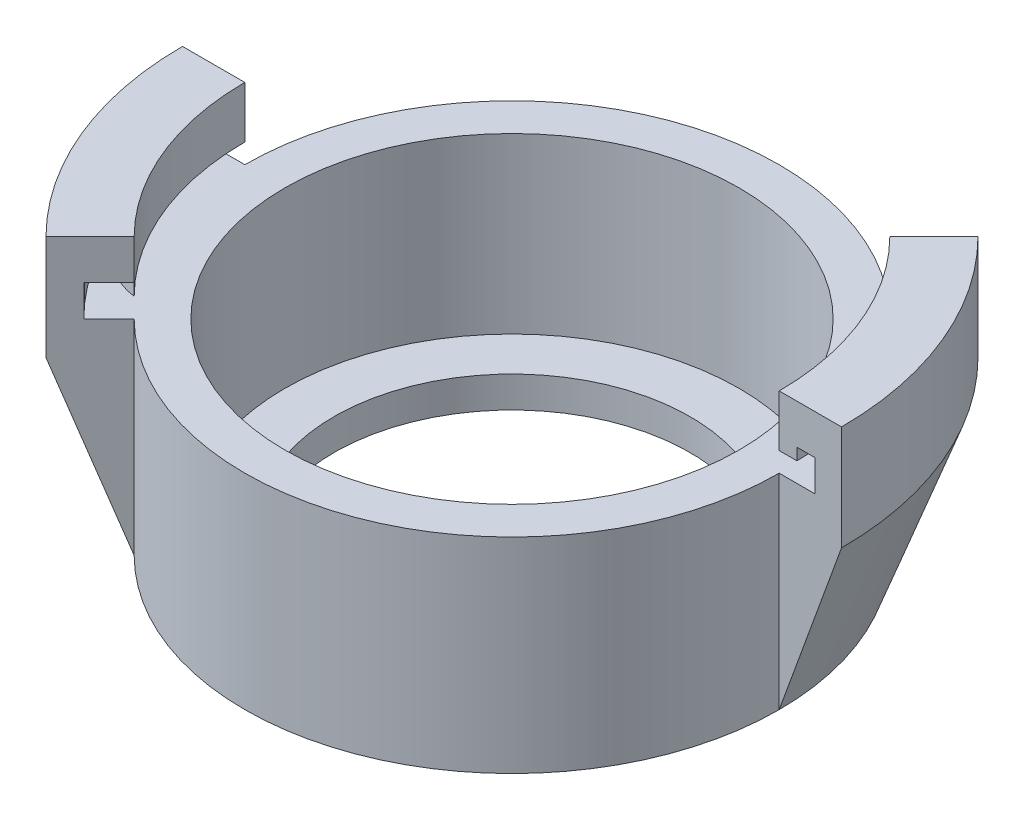
from build123d import *

# Parameters (mm, degrees)
SKETCH_1_R          = 30
SKETCH_1_R_2        = 25.5
EXTRUDE_1_DEPTH     = 23
SKETCH_2_R          = 25.5
SKETCH_2_R_2        = 20
EXTRUDE_2_DEPTH     = 3.5
REVOLVE_1_ANGLE     = 45
CUT_EXTRUDE_1_DEPTH = 1.32
CUT_EXTRUDE_3_DEPTH = 1.32


with BuildPart() as part:
    # 草图1 → 凸台-拉伸1 (new body)
    with BuildSketch(Plane(origin=(0, 0, 0), x_dir=(1, 0, 0), z_dir=(0, 1, 0))):
        with Locations(Location((0, 0, 0), (0, 0, 270))):
            Circle(SKETCH_1_R)
        with Locations(Location((0, 0, 0), (0, 0, 270))):
            Circle(SKETCH_1_R_2, mode=Mode.SUBTRACT)
    extrude(amount=EXTRUDE_1_DEPTH)

    # 草图2 → 凸台-拉伸2 (add)
    with BuildSketch(Plane(origin=(0, 0, 0), x_dir=(1, 0, 0), z_dir=(0, 1, 0))):
        with Locations(Location((0, 0, 0), (0, 0, 270))):
            Circle(SKETCH_2_R)
        with Locations(Location((0, 0, 0), (0, 0, 270))):
            Circle(SKETCH_2_R_2, mode=Mode.SUBTRACT)
    extrude(amount=EXTRUDE_2_DEPTH)

    # 草图3 → 旋转1 (revolve)
    with BuildSketch(Plane.XY):
        Polygon((-30, 0), (-37, 19.23), (-37, 31), (-30, 31), (-30, 25.2), (-32, 25.2), (-32, 26.519651463), (-34, 26.519651463), (-34, 23), (-30, 23), align=None)
    revolve_1 = revolve(axis=Axis((0, 0, 0), (0, 1, 0)), revolution_arc=REVOLVE_1_ANGLE)

    # 镜向1: 旋转1 across plane
    add(revolve_1.mirror(Plane(origin=(0, 0, 0), x_dir=(0.3826834323650901, 0, 0.9238795325112866), z_dir=(0.9238795325112867, 0, -0.38268343236509006))))

    # 草图5 → 切除-拉伸1 (cut)
    with BuildSketch(Plane.XZ.offset(-25.2)):
        with BuildLine():
            Line((-26.405413435, 18.076342033), (-25.672211093, 21.213203436))
            Line((-25.672211093, 21.213203436), (-22.063062958, 24.949941075))
            Line((-22.063062958, 24.949941075), (-17.99117048, 21.673033438))
            Line((-17.99117048, 21.673033438), (-21.213203436, 21.213203436))
            ThreePointArc((-21.213203436, 21.213203436), (-24.149079473, 20.207170096), (-26.405413435, 18.076342033))
        make_face()
    extrude(amount=-CUT_EXTRUDE_1_DEPTH, mode=Mode.SUBTRACT)

    # 草图8 → 切除-拉伸3 (cut)
    with BuildSketch(Plane.XZ.offset(-25.2)):
        with BuildLine():
            Line((26.407763212, -18.072909066), (22.874853187, -24.345219229))
            Line((22.874853187, -24.345219229), (19.318976471, -22.342353909))
            Line((19.318976471, -22.342353909), (21.213203436, -21.213203436))
            ThreePointArc((21.213203436, -21.213203436), (24.150606635, -20.205675758), (26.407763212, -18.072909066))
        make_face()
    extrude(amount=-CUT_EXTRUDE_3_DEPTH, mode=Mode.SUBTRACT)


solid = part.part
